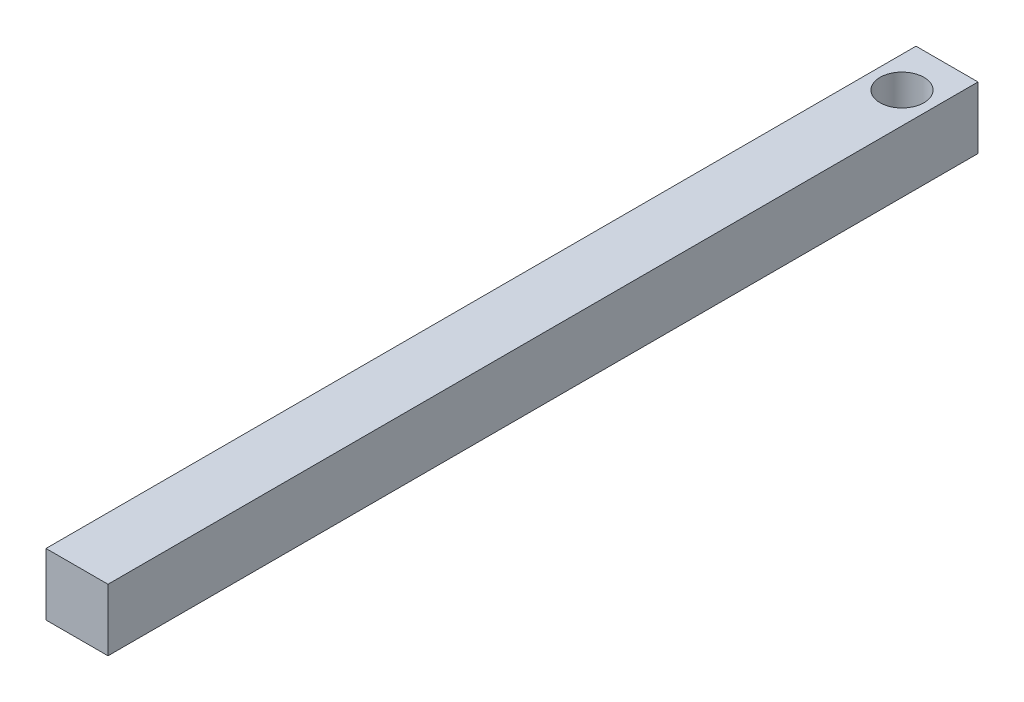
from build123d import *

# Parameters (mm, degrees)
SKETCH1_W           = 6.2
SKETCH1_H           = 6.2
BOSS_EXTRUDE1_DEPTH = 90
SKETCH2_W           = 6.2
SKETCH2_H           = 3
SKETCH2_R           = 2.2
CUT_EXTRUDE1_DEPTH  = 10


with BuildPart() as part:
    # Sketch1 → Boss-Extrude1 (new body)
    with BuildSketch(Plane.XY):
        Rectangle(SKETCH1_W, SKETCH1_H)
    extrude(amount=BOSS_EXTRUDE1_DEPTH)

    # Sketch2 → Cut-Extrude1 (cut)
    with BuildSketch(Plane(origin=(0, 3.1, 0), x_dir=(1, 0, 0), z_dir=(0, 1, 0))):
        with Locations((0, -1.5)):
            Rectangle(SKETCH2_W, SKETCH2_H)
        with Locations(Location((0, -7.5, 0), (0, 0, 270))):
            Circle(SKETCH2_R)
    extrude(amount=-CUT_EXTRUDE1_DEPTH, mode=Mode.SUBTRACT)


solid = part.part
